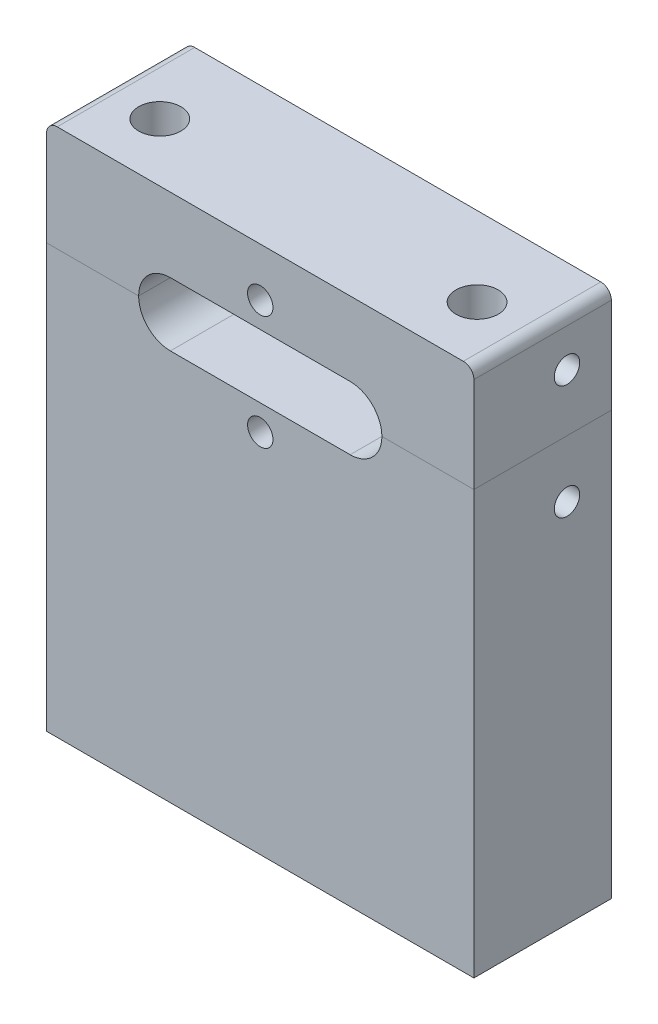
from build123d import *

# Parameters (mm, degrees)
SKETCH1_W           = 25.654
SKETCH1_H           = 8.255
BOSS_EXTRUDE1_DEPTH = 31.75
CUT_EXTRUDE1_DEPTH  = 25.4
SKETCH8_R           = 0.762
CUT_REVOLVE1_ANGLE  = 90.0000000000002
CUT_EXTRUDE4_REACH  = 43.027
SKETCH9_R           = 0.7620000000000002
FILLET1_R           = 0.635
SKETCH10_R          = 1.2700000000000014
SKETCH10_R_2        = 1.2699999999999994
CUT_EXTRUDE5_DEPTH  = 12.7


with BuildPart() as part:
    # Sketch1 → Boss-Extrude1 (new body)
    with BuildSketch(Plane(origin=(0, 0, 0), x_dir=(1, 0, 0), z_dir=(0, 1, 0))):
        Rectangle(SKETCH1_W, SKETCH1_H)
    extrude(amount=BOSS_EXTRUDE1_DEPTH)

    # Sketch2 → Cut-Extrude1 (cut)
    with BuildSketch(Plane(origin=(0, 0, -4.1274999999999995), x_dir=(-1, 0, 0), z_dir=(0, 0, -1))):
        with BuildLine():
            Line((5.397499999999999, 23.494999999999997), (-5.397500000000001, 23.494999999999994))
            ThreePointArc((-5.397500000000001, 23.494999999999994), (-7.3025000000000055, 25.399999999999995), (-5.397500000000002, 27.305))
            Line((-5.397500000000002, 27.305), (5.397499999999997, 27.305000000000003))
            ThreePointArc((5.397499999999997, 27.305000000000003), (7.302499999999999, 25.4), (5.397499999999999, 23.494999999999997))
        make_face()
    extrude(amount=-CUT_EXTRUDE1_DEPTH, mode=Mode.SUBTRACT)

    # Sketch8 → Cut-Revolve1 (revolve, cut)
    with BuildSketch(Plane.XY.offset(4.127500000000001)):
        with Locations((0, 28.828999999999994)):
            Circle(SKETCH8_R)
        with Locations((0, 21.97099999999999)):
            Circle(SKETCH8_R)
    revolve(axis=Axis((5.588, 31.75, 4.127500000000001), (0, -1, 0)), revolution_arc=CUT_REVOLVE1_ANGLE, mode=Mode.SUBTRACT)

    # Sketch9 → Cut-Extrude4 (cut, up to next)
    with BuildSketch(Plane(origin=(12.826999999999996, 0, 0), x_dir=(0, 0, -1), z_dir=(1, 0, 0)), mode=Mode.PRIVATE) as cut_extrude4_sk1:
        with Locations((1.4604999999999988, 28.828999999999994)):
            Circle(SKETCH9_R)
    cut_extrude4_tool1 = extrude(cut_extrude4_sk1.sketch, amount=-CUT_EXTRUDE4_REACH, mode=Mode.PRIVATE) & part.part
    # Sketch9 → Cut-Extrude4 (cut, up to next)
    with BuildSketch(Plane(origin=(12.826999999999996, 0, 0), x_dir=(0, 0, -1), z_dir=(1, 0, 0)), mode=Mode.PRIVATE) as cut_extrude4_sk2:
        with Locations((1.4604999999999988, 21.97099999999999)):
            Circle(SKETCH9_R)
    cut_extrude4_tool2 = extrude(cut_extrude4_sk2.sketch, amount=-CUT_EXTRUDE4_REACH, mode=Mode.PRIVATE) & part.part
    add(cut_extrude4_tool1.solids().sort_by_distance((12.827, 28.829, -1.4605))[0], mode=Mode.SUBTRACT)
    add(cut_extrude4_tool2.solids().sort_by_distance((12.827, 21.971, -1.4605))[0], mode=Mode.SUBTRACT)

    # Fillet1
    fillet1_edges = [part.edges().sort_by_distance(p)[0] for p in [
        (-12.827000000000004, 31.75, 8.9e-16),
        (12.826999999999996, 31.75, 8.9e-16),
    ]]
    fillet(fillet1_edges, radius=FILLET1_R)

    # Sketch10 → Cut-Extrude5 (cut)
    with BuildSketch(Plane(origin=(0, 31.75, 0), x_dir=(1, 0, 0), z_dir=(0, 1, 0))):
        with Locations((9.525, -0.635)):
            Circle(SKETCH10_R)
        with Locations((-9.525, -0.635)):
            Circle(SKETCH10_R_2)
    extrude(amount=-CUT_EXTRUDE5_DEPTH, mode=Mode.SUBTRACT)


with BuildPart() as body_2:
    # Split1: the piece on the far side of the plane
    add(part.part)
    split(bisect_by=Plane.ZX.offset(25.4), keep=Keep.BOTTOM)


with BuildPart() as part_1:
    add(part.part)

    # Split1
    split(bisect_by=Plane.ZX.offset(25.4), keep=Keep.TOP)


solid = Compound([body_2.part, part_1.part])
